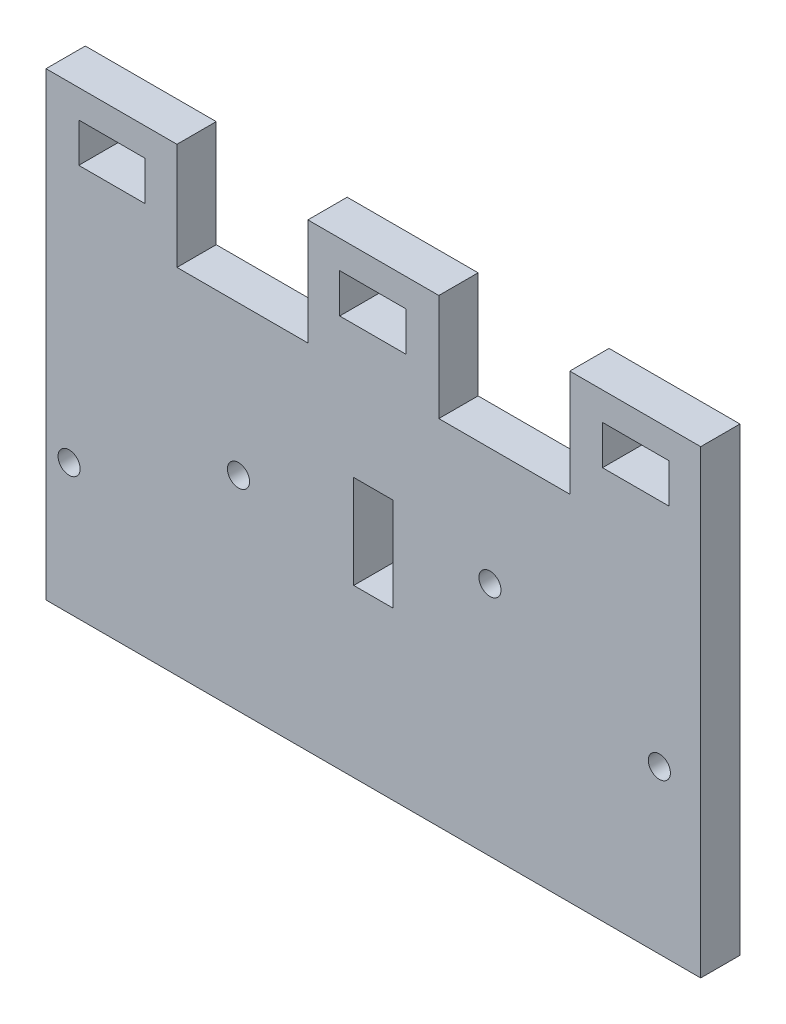
from build123d import *

# Parameters (mm, degrees)
SKETCH1_W           = 88.9
SKETCH1_H           = 62.484
BOSS_EXTRUDE1_DEPTH = 5.334
SKETCH2_W           = 17.78
SKETCH2_H           = 14.478
CUT_EXTRUDE1_DEPTH  = 70.229357574
SKETCH3_W           = 9.017
SKETCH3_H           = 5.334
CUT_EXTRUDE2_DEPTH  = 70.229357574
SKETCH5_W           = 5.334
SKETCH5_H           = 12.7
CUT_EXTRUDE3_DEPTH  = 70.229357574
SKETCH7_R           = 1.5
CUT_EXTRUDE4_DEPTH  = 70.229357574


with BuildPart() as part:
    # Sketch1 → Boss-Extrude1 (new body)
    with BuildSketch(Plane.XY):
        with Locations((5.089694656, -16.821198473)):
            Rectangle(SKETCH1_W, SKETCH1_H)
    extrude(amount=BOSS_EXTRUDE1_DEPTH)

    # Sketch2 → Cut-Extrude1 (cut, through all)
    with BuildSketch(Plane.XY.offset(5.334)):
        with Locations((-12.690305344, 7.181801527)):
            Rectangle(SKETCH2_W, SKETCH2_H)
        with Locations((22.869694656, 7.181801527)):
            Rectangle(SKETCH2_W, SKETCH2_H)
    extrude(amount=-CUT_EXTRUDE1_DEPTH, mode=Mode.SUBTRACT)

    # Sketch3 → Cut-Extrude2 (cut, through all)
    with BuildSketch(Plane.XY.offset(5.334)):
        with Locations((-30.406805344, 7.943801527)):
            Rectangle(SKETCH3_W, SKETCH3_H)
        with Locations((5.026194656, 7.943801527)):
            Rectangle(SKETCH3_W, SKETCH3_H)
        with Locations((40.713194656, 7.943801527)):
            Rectangle(SKETCH3_W, SKETCH3_H)
    extrude(amount=-CUT_EXTRUDE2_DEPTH, mode=Mode.SUBTRACT)

    # Sketch5 → Cut-Extrude3 (cut, through all)
    with BuildSketch(Plane.XY.offset(5.334)):
        with Locations((5.089694656, -19.107198473)):
            Rectangle(SKETCH5_W, SKETCH5_H)
    extrude(amount=-CUT_EXTRUDE3_DEPTH, mode=Mode.SUBTRACT)

    # Sketch7 → Cut-Extrude4 (cut, through all)
    with BuildSketch(Plane.XY.offset(5.334)):
        with Locations((-36.225305344, -30.329198473)):
            Circle(SKETCH7_R)
        with Locations((20.924694656, -16.011198473)):
            Circle(SKETCH7_R)
        with Locations((43.924694656, -26.011198473)):
            Circle(SKETCH7_R)
        with Locations((-13.225305344, -20.329198473)):
            Circle(SKETCH7_R)
    extrude(amount=-CUT_EXTRUDE4_DEPTH, mode=Mode.SUBTRACT)


solid = part.part
